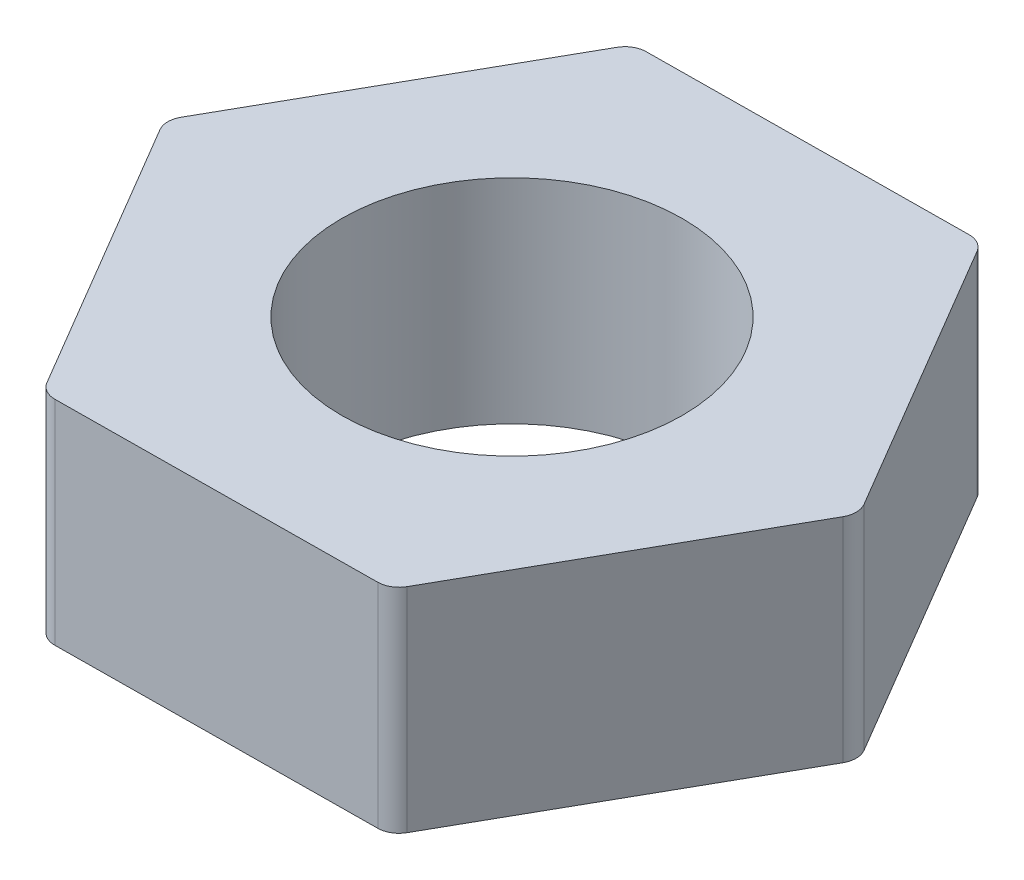
from build123d import *

# Parameters (mm, degrees)
BOSS_EXTRUDE1_DEPTH = 2.5
SKETCH2_R           = 2
CUT_EXTRUDE1_DEPTH  = 6.912925747
FILLET1_R           = 0.25


with BuildPart() as part:
    # Sketch1 → Boss-Extrude1 (new body)
    with BuildSketch(Plane(origin=(0, 0, 0), x_dir=(1, 0, 0), z_dir=(0, 1, 0))):
        Polygon((1.98810578, 3.518631658), (-2.053171512, 3.481065939), (-4.041277292, -0.037565718), (-1.98810578, -3.518631658), (2.053171512, -3.481065939), (4.041277292, 0.037565718), align=None)
    extrude(amount=BOSS_EXTRUDE1_DEPTH)

    # Sketch2 → Cut-Extrude1 (cut, through all)
    with BuildSketch(Plane(origin=(0, 2.5, 0), x_dir=(1, 0, 0), z_dir=(0, 1, 0))):
        Circle(SKETCH2_R)
    extrude(amount=-CUT_EXTRUDE1_DEPTH, mode=Mode.SUBTRACT)

    # Fillet1
    fillet1_edges = [part.edges().sort_by_distance(p)[0] for p in [
        (2.053171512, 1.25, 3.481065939),
        (4.041277292, 1.25, -0.037565718),
        (1.98810578, 1.25, -3.518631658),
        (-2.053171512, 1.25, -3.481065939),
        (-4.041277292, 1.25, 0.037565718),
        (-1.98810578, 1.25, 3.518631658),
    ]]
    fillet(fillet1_edges, radius=FILLET1_R)


solid = part.part
